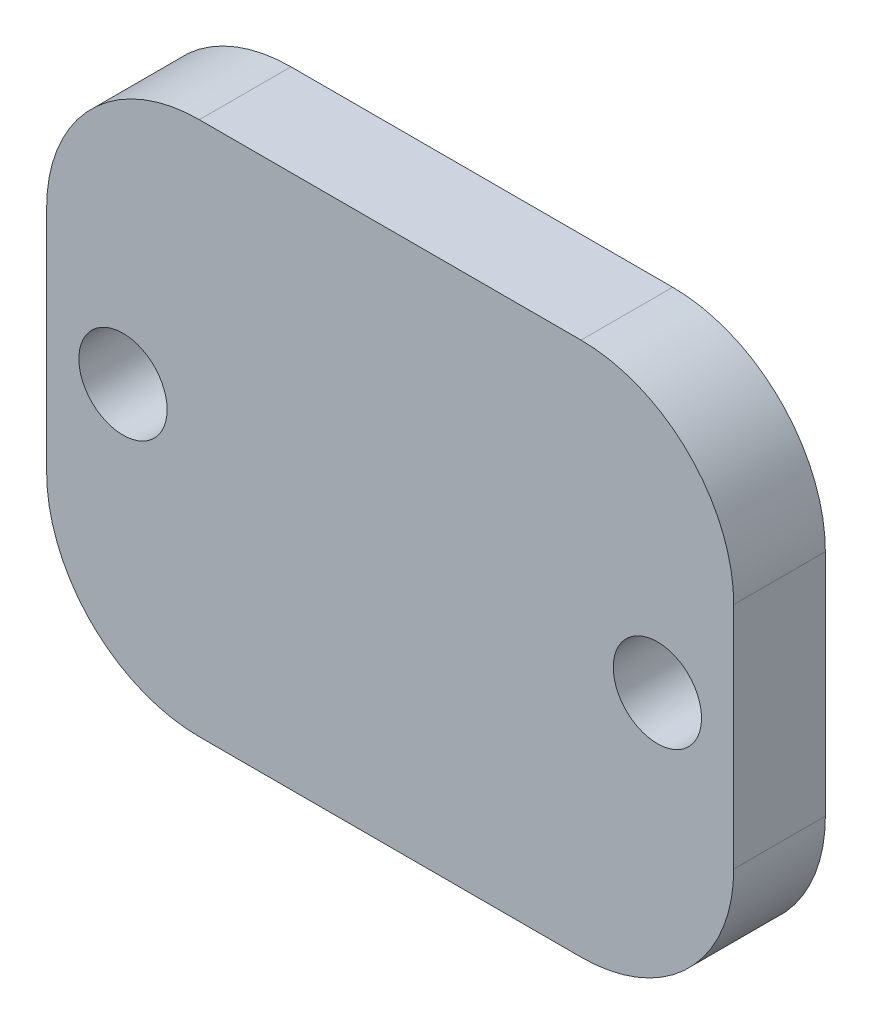
from build123d import *

# Parameters (mm, degrees)
SKETCH2_R           = 2.89
BOSS_EXTRUDE1_DEPTH = 6


with BuildPart() as part:
    # Sketch2 → Boss-Extrude1 (new body)
    with BuildSketch(Plane.XY):
        with BuildLine():
            Line((-134.400976219, 43.701721803), (-109.400976219, 43.701721803))
            ThreePointArc((-109.400976219, 43.701721803), (-102.329908407, 40.772789615), (-99.400976219, 33.701721803))
            Line((-99.400976219, 33.701721803), (-99.400976219, 18.701721803))
            ThreePointArc((-99.400976219, 18.701721803), (-102.329908407, 11.630653991), (-109.400976219, 8.701721803))
            Line((-109.400976219, 8.701721803), (-134.400976219, 8.701721803))
            ThreePointArc((-134.400976219, 8.701721803), (-141.472044031, 11.630653991), (-144.400976219, 18.701721803))
            Line((-144.400976219, 18.701721803), (-144.400976219, 33.701721803))
            ThreePointArc((-144.400976219, 33.701721803), (-141.472044031, 40.772789615), (-134.400976219, 43.701721803))
        make_face()
        with Locations((-139.400925623, 26.201721803)):
            Circle(SKETCH2_R, mode=Mode.SUBTRACT)
        with Locations(Location((-104.401026816, 26.201721803, 0), (0, 0, 180))):
            Circle(SKETCH2_R, mode=Mode.SUBTRACT)
    extrude(amount=BOSS_EXTRUDE1_DEPTH)


solid = part.part
